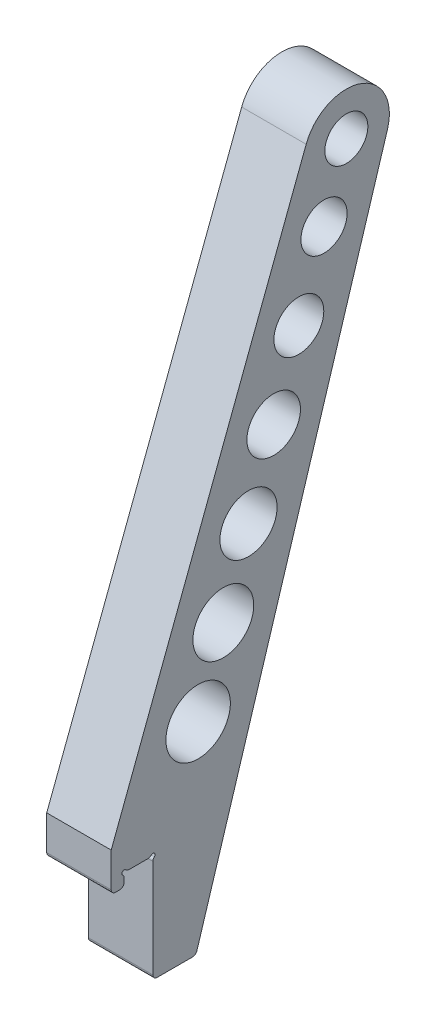
from build123d import *

# Parameters (mm, degrees)
SKETCH2_R           = 5
SKETCH2_R_2         = 7.5
SKETCH2_R_3         = 7.07534444
SKETCH2_R_4         = 6.65068888
SKETCH2_R_5         = 6.226033319
SKETCH2_R_6         = 5.801377759
SKETCH2_R_7         = 5.376722199
BOSS_EXTRUDE1_DEPTH = 15
SKETCH3_R           = 0.5
CUT_EXTRUDE2_DEPTH  = 144.75069455
FILLET1_R           = 1
FILLET3_R           = 1
SKETCH4_R           = 2
CUT_EXTRUDE3_DEPTH  = 9


with BuildPart() as part:
    # Sketch2 → Boss-Extrude1 (new body)
    with BuildSketch(Plane(origin=(0, 0, 0), x_dir=(0, 0, -1), z_dir=(1, 0, 0))):
        with BuildLine():
            Line((0, 0), (-6.7, 0))
            Line((-6.7, 0), (-6.7, -3))
            Line((-6.7, -3), (-9.7, -3))
            Line((-9.7, -3), (-9.7, 6))
            Line((-9.7, 6), (35.650511948, 125.510935717))
            ThreePointArc((35.650511948, 125.510935717), (48.253306586, 131.419112363), (54.553243165, 119.007513631))
            Line((54.553243165, 119.007513631), (10, -25))
            Line((10, -25), (0, -25))
            Line((0, -25), (0, 0))
        make_face()
        with Locations((45, 121.963109177)):
            Circle(SKETCH2_R, mode=Mode.SUBTRACT)
        with Locations((10.525284468, 21.759512837)):
            Circle(SKETCH2_R_2, mode=Mode.SUBTRACT)
        with Locations((16.381236323, 38.780318572)):
            Circle(SKETCH2_R_3, mode=Mode.SUBTRACT)
        with Locations((22.237188178, 55.801124308)):
            Circle(SKETCH2_R_4, mode=Mode.SUBTRACT)
        with Locations((28.093140033, 72.821930043)):
            Circle(SKETCH2_R_5, mode=Mode.SUBTRACT)
        with Locations((33.949091887, 89.842735778)):
            Circle(SKETCH2_R_6, mode=Mode.SUBTRACT)
        with Locations((39.805043742, 106.863541513)):
            Circle(SKETCH2_R_7, mode=Mode.SUBTRACT)
    extrude(amount=BOSS_EXTRUDE1_DEPTH)

    # Sketch3 → Cut-Extrude2 (cut, through all)
    with BuildSketch(Plane(origin=(0, 0, 0), x_dir=(0, 0, -1), z_dir=(1, 0, 0))):
        Circle(SKETCH3_R)
        with Locations((-6.7, 0)):
            Circle(SKETCH3_R)
    extrude(amount=CUT_EXTRUDE2_DEPTH, mode=Mode.SUBTRACT)

    # Fillet1
    fillet1_edges = [part.edges().sort_by_distance(p)[0] for p in [
        (7.5, -3, 6.7),
        (7.5, -3, 9.7),
        (7.5, -0.5, 0),
        (7.5, 0, 6.2),
        (7.5, 0, 0.5),
        (7.5, -0.5, 6.7),
    ]]
    fillet(fillet1_edges, radius=FILLET1_R)

    # Fillet3
    fillet3_edges = [part.edges().sort_by_distance(p)[0] for p in [
        (7.5, -25, -10),
        (7.5, -25, 0),
    ]]
    fillet(fillet3_edges, radius=FILLET3_R)

    # Sketch4 → Cut-Extrude3 (cut)
    with BuildSketch(Plane.XZ.offset(25)):
        with Locations(Location((7.5, -5, 0), (0, 0, 270))):
            Circle(SKETCH4_R)
    extrude(amount=-CUT_EXTRUDE3_DEPTH, mode=Mode.SUBTRACT)


solid = part.part
